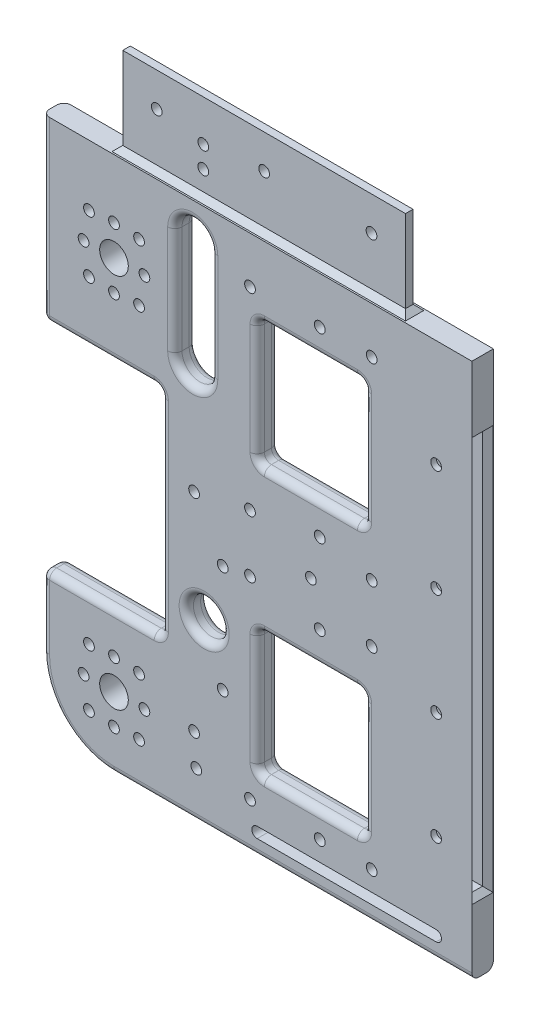
from build123d import *

# Parameters (mm, degrees)
SKETCH_1_W              = 120
SKETCH_1_H              = 150
EXTRUDE_305_DEPTH       = 3
SKETCH_3_W              = 2.9
SKETCH_3_H              = 110
CUT_EXTRUDE_479_DEPTH   = 20
SKETCH_4_W              = 79
SKETCH_4_H              = 2.1
EXTRUDE_650_DEPTH       = 24.5
SKETCH_5_W              = 33.2
SKETCH_5_H              = 60
CUT_EXTRUDE_912_DEPTH   = 10
SKETCH_7_R              = 1.5
CUT_EXTRUDE_1275_DEPTH  = 10
SKETCH_6_R              = 1.5
CUT_EXTRUDE_1586_DEPTH  = 10
SKETCH_8_R              = 1.5
CUT_EXTRUDE_1967_DEPTH  = 10
SKETCH_9_R              = 1.5
CUT_EXTRUDE_2487_DEPTH  = 10
SKETCH_14_R             = 1.5
CUT_EXTRUDE_3129_DEPTH  = 10
CUT_EXTRUDE_4236_DEPTH  = 10
SKETCH_16_R             = 5
SKETCH_16_W             = 30
SKETCH_16_H             = 35
CUT_EXTRUDE_4919_DEPTH  = 10
SKETCH_10_R             = 4
SKETCH_10_R_2           = 1.5
CUT_EXTRUDE_1_DEPTH     = 10
SKETCH_11_R             = 4
SKETCH_11_R_2           = 1.5
CUT_EXTRUDE_2_DEPTH     = 10
SKETCH_13_R             = 1.5
CUT_EXTRUDE_1_2_DEPTH   = 10
SKETCH_12_R             = 1.5
CUT_EXTRUDE_2_2_DEPTH   = 10
SKETCH_18_R             = 1.5
CUT_EXTRUDE_7600_DEPTH  = 10
CHAMFER_7649_SIZE       = 1.5
CHAMFER_7735_SIZE       = 1.5
FILLET_7819_R           = 20
FILLET_7890_R           = 2
FILLET_9097_R           = 2
FILLET_9538_R           = 2
CUT_EXTRUDE_10966_DEPTH = 10


with BuildPart() as part:
    # 草图1 → Extrude 305 (new, symmetric)
    with BuildSketch(Plane.XY):
        Rectangle(SKETCH_1_W, SKETCH_1_H)
    extrude(amount=EXTRUDE_305_DEPTH, both=True)

    # 草图3 → Cut-Extrude 479 (cut)
    with BuildSketch(Plane(origin=(60, 0, 0), x_dir=(0, 0, -1), z_dir=(1, 0, 0))):
        Rectangle(SKETCH_3_W, SKETCH_3_H)
    extrude(amount=-CUT_EXTRUDE_479_DEPTH, mode=Mode.SUBTRACT)

    # 草图4 → Extrude 650 (add)
    with BuildSketch(Plane(origin=(0, 75, 0), x_dir=(1, 0, 0), z_dir=(0, 1, 0))):
        Rectangle(SKETCH_4_W, SKETCH_4_H)
    extrude(amount=EXTRUDE_650_DEPTH)

    # 草图5 → Cut-Extrude 912 (cut)
    with BuildSketch(Plane.XY.offset(3)):
        with Locations((-43.4, -5)):
            Rectangle(SKETCH_5_W, SKETCH_5_H)
    extrude(amount=-CUT_EXTRUDE_912_DEPTH, mode=Mode.SUBTRACT)

    # 草图7 → Cut-Extrude 1275 (cut)
    with BuildSketch(Plane.XY.offset(3)):
        with Locations((50, 45)):
            Circle(SKETCH_7_R)
        with Locations((50, 15)):
            Circle(SKETCH_7_R)
        with Locations((50, -15)):
            Circle(SKETCH_7_R)
        with Locations((50, -45)):
            Circle(SKETCH_7_R)
    extrude(amount=-CUT_EXTRUDE_1275_DEPTH, mode=Mode.SUBTRACT)

    # 草图6 → Cut-Extrude 1586 (cut)
    with BuildSketch(Plane.XY.offset(1.05)):
        with Locations((-30, 90)):
            Circle(SKETCH_6_R)
        with Locations((0, 90)):
            Circle(SKETCH_6_R)
        with Locations((30, 90)):
            Circle(SKETCH_6_R)
    extrude(amount=-CUT_EXTRUDE_1586_DEPTH, mode=Mode.SUBTRACT)

    # 草图8 → Cut-Extrude 1967 (cut)
    with BuildSketch(Plane.XY.offset(3)):
        with Locations((17.5, 62)):
            Circle(SKETCH_8_R)
        with Locations((17.5, 11.2)):
            Circle(SKETCH_8_R)
        with Locations((17.5, -11.2)):
            Circle(SKETCH_8_R)
        with Locations((17.5, -62)):
            Circle(SKETCH_8_R)
    extrude(amount=-CUT_EXTRUDE_1967_DEPTH, mode=Mode.SUBTRACT)

    # 草图9 → Cut-Extrude 2487 (cut)
    with BuildSketch(Plane.XY.offset(3)):
        with Locations((-2, 62)):
            Circle(SKETCH_9_R)
        with Locations((32, -62)):
            Circle(SKETCH_9_R)
        with Locations((32, 62)):
            Circle(SKETCH_9_R)
        with Locations((-2, -62)):
            Circle(SKETCH_9_R)
        with Locations((-2, 8)):
            Circle(SKETCH_9_R)
        with Locations((-2, -8)):
            Circle(SKETCH_9_R)
        with Locations((32, 8)):
            Circle(SKETCH_9_R)
        with Locations((32, -8)):
            Circle(SKETCH_9_R)
    extrude(amount=-CUT_EXTRUDE_2487_DEPTH, mode=Mode.SUBTRACT)

    # 草图14 → Cut-Extrude 3129 (cut)
    with BuildSketch(Plane.XY.offset(3)):
        with Locations((-17.62, -53.4)):
            Circle(SKETCH_14_R)
        with Locations((-17.62, 4.6)):
            Circle(SKETCH_14_R)
        with Locations((-9.62, -9.4)):
            Circle(SKETCH_14_R)
        with Locations((-9.62, -39.4)):
            Circle(SKETCH_14_R)
    extrude(amount=-CUT_EXTRUDE_3129_DEPTH, mode=Mode.SUBTRACT)

    # 草图15 → Cut-Extrude 4236 (cut)
    with BuildSketch(Plane.XY.offset(3)):
        with BuildLine():
            ThreePointArc((-13, 65), (-18, 70), (-23, 65))
            Line((-23, 65), (-13, 65))
        make_face()
        with BuildLine():
            Line((-13, 65), (-23, 65))
            ThreePointArc((-23, 65), (-18, 60), (-13, 65))
        make_face()
        with BuildLine():
            ThreePointArc((-13, 65), (-18, 60), (-23, 65))
            Line((-23, 65), (-23, 35))
            ThreePointArc((-23, 35), (-18, 40), (-13, 35))
            Line((-13, 35), (-13, 65))
        make_face()
        with BuildLine():
            ThreePointArc((-13, 35), (-18, 40), (-23, 35))
            Line((-23, 35), (-13, 35))
        make_face()
        with BuildLine():
            Line((-13, 35), (-23, 35))
            ThreePointArc((-23, 35), (-18, 30), (-13, 35))
        make_face()
    extrude(amount=-CUT_EXTRUDE_4236_DEPTH, mode=Mode.SUBTRACT)

    # 草图16 → Cut-Extrude 4919 (cut)
    with BuildSketch(Plane.XY.offset(3)):
        with Locations((-14.8, -25)):
            Circle(SKETCH_16_R)
        with Locations((15, 37.5)):
            Rectangle(SKETCH_16_W, SKETCH_16_H)
        with Locations((15, -37.5)):
            Rectangle(SKETCH_16_W, SKETCH_16_H)
    extrude(amount=-CUT_EXTRUDE_4919_DEPTH, mode=Mode.SUBTRACT)

    # 草图10 → Cut-Extrude 1 (cut)
    with BuildSketch(Plane.XY.offset(3)):
        with Locations((-40, 50)):
            Circle(SKETCH_10_R)
        with Locations((-33, 58)):
            Circle(SKETCH_10_R_2)
        with Locations((-47, 58)):
            Circle(SKETCH_10_R_2)
        with Locations((-47, 42)):
            Circle(SKETCH_10_R_2)
        with Locations((-33, 42)):
            Circle(SKETCH_10_R_2)
        with Locations((-31.5, 50)):
            Circle(SKETCH_10_R_2)
        with Locations((-48.5, 50)):
            Circle(SKETCH_10_R_2)
        with Locations((-40, 58.5)):
            Circle(SKETCH_10_R_2)
        with Locations((-40, 41.5)):
            Circle(SKETCH_10_R_2)
    extrude(amount=-CUT_EXTRUDE_1_DEPTH, mode=Mode.SUBTRACT)

    # 草图11 → Cut-Extrude 2 (cut)
    with BuildSketch(Plane.XY.offset(3)):
        with Locations((-40, -55)):
            Circle(SKETCH_11_R)
        with Locations((-40, -46.5)):
            Circle(SKETCH_11_R_2)
        with Locations((-31.5, -55)):
            Circle(SKETCH_11_R_2)
        with Locations((-40, -63.5)):
            Circle(SKETCH_11_R_2)
        with Locations((-48.5, -55)):
            Circle(SKETCH_11_R_2)
        with Locations((-33, -63)):
            Circle(SKETCH_11_R_2)
        with Locations((-47, -63)):
            Circle(SKETCH_11_R_2)
        with Locations((-47, -47)):
            Circle(SKETCH_11_R_2)
        with Locations((-33, -47)):
            Circle(SKETCH_11_R_2)
    extrude(amount=-CUT_EXTRUDE_2_DEPTH, mode=Mode.SUBTRACT)

    # 草图13 → Cut-Extrude 1 2 (cut)
    with BuildSketch(Plane.XY.offset(1.05)):
        with Locations((-17, 88)):
            Circle(SKETCH_13_R)
        with Locations((-17, 82)):
            Circle(SKETCH_13_R)
    extrude(amount=-CUT_EXTRUDE_1_2_DEPTH, mode=Mode.SUBTRACT)

    # 草图12 → Cut-Extrude 2 2 (cut)
    with BuildSketch(Plane.XY.offset(3)):
        with Locations((-17, -62)):
            Circle(SKETCH_12_R)
    extrude(amount=-CUT_EXTRUDE_2_2_DEPTH, mode=Mode.SUBTRACT)

    # 草图18 → Cut-Extrude 7600 (cut)
    with BuildSketch(Plane.XY.offset(3)):
        with Locations((15, 0)):
            Circle(SKETCH_18_R)
    extrude(amount=-CUT_EXTRUDE_7600_DEPTH, mode=Mode.SUBTRACT)

    # Chamfer 7649
    chamfer_7649_edges = [part.edges().sort_by_distance(p)[0] for p in [
        (60, 0, -1.45),
        (60, 55, 0),
        (60, 0, 1.45),
        (60, -55, 0),
    ]]
    chamfer(chamfer_7649_edges, length=CHAMFER_7649_SIZE)

    # Chamfer 7735
    chamfer_7735_edges = [part.edges().sort_by_distance(p)[0] for p in [
        (39.5, 75, 0),
        (0, 75, -1.05),
        (-39.5, 75, 0),
        (0, 75, 1.05),
    ]]
    chamfer(chamfer_7735_edges, length=CHAMFER_7735_SIZE)

    # Fillet 7819
    fillet_7819_edges = [part.edges().sort_by_distance(p)[0] for p in [
        (-60, -75, 0),
    ]]
    fillet(fillet_7819_edges, radius=FILLET_7819_R)

    # Fillet 7890
    fillet_7890_edges = [part.edges().sort_by_distance(p)[0] for p in [
        (15, -55, -3),
        (30, -37.5, -3),
        (15, -20, -3),
        (0, -37.5, -3),
        (15, 20, -3),
        (30, 37.5, -3),
        (15, 55, -3),
        (0, 37.5, -3),
        (0, 20, 0),
        (0, 55, 0),
        (30, 55, 0),
        (30, 20, 0),
        (0, 37.5, 3),
        (15, 20, 3),
        (30, 37.5, 3),
        (15, 55, 3),
        (0, -55, 0),
        (0, -20, 0),
        (30, -20, 0),
        (30, -55, 0),
        (0, -37.5, 3),
        (15, -55, 3),
        (30, -37.5, 3),
        (15, -20, 3),
        (-19.8, -25, -3),
        (-19.8, -25, 3),
    ]]
    fillet(fillet_7890_edges, radius=FILLET_7890_R)

    # Fillet 9097
    fillet_9097_edges = [part.edges().sort_by_distance(p)[0] for p in [
        (-23, 50, -3),
        (-18, 30, -3),
        (-13, 50, -3),
        (-18, 70, -3),
        (-13, 50, 3),
        (-18, 70, 3),
        (-23, 50, 3),
        (-18, 30, 3),
    ]]
    fillet(fillet_9097_edges, radius=FILLET_9097_R)

    # Fillet 9538
    fillet_9538_edges = [part.edges().sort_by_distance(p)[0] for p in [
        (-60, 50, 3),
        (-60, -45, -3),
        (-43.4, -35, -3),
        (-26.8, -5, -3),
        (-43.4, 25, -3),
        (10, -75, -3),
        (10, -75, 3),
        (-54.142135624, -69.142135624, -3),
        (-54.142135624, -69.142135624, 3),
        (-60, -45, 3),
        (-60, -35, 0),
        (-60, 25, 0),
        (-26.8, 25, 0),
        (-26.8, -35, 0),
        (-43.4, -35, 3),
        (-26.8, -5, 3),
        (-43.4, 25, 3),
        (-60, 50, -3),
    ]]
    fillet(fillet_9538_edges, radius=FILLET_9538_R)

    # 草图19 → Cut-Extrude 10966 (cut)
    with BuildSketch(Plane.XY.offset(3)):
        with BuildLine():
            ThreePointArc((1.5, -69), (1.060660172, -67.939339828), (0, -67.5))
            Line((0, -67.5), (0, -70.5))
            ThreePointArc((0, -70.5), (1.060660172, -70.060660172), (1.5, -69))
        make_face()
        with BuildLine():
            Line((0, -70.5), (0, -67.5))
            ThreePointArc((0, -67.5), (-1.5, -69), (0, -70.5))
        make_face()
        with BuildLine():
            Line((50, -67.5), (0, -67.5))
            ThreePointArc((0, -67.5), (1.060660172, -67.939339828), (1.5, -69))
            ThreePointArc((1.5, -69), (1.060660172, -70.060660172), (0, -70.5))
            Line((0, -70.5), (50, -70.5))
            ThreePointArc((50, -70.5), (48.5, -69), (50, -67.5))
        make_face()
        with BuildLine():
            ThreePointArc((51.5, -69), (51.060660172, -67.939339828), (50, -67.5))
            Line((50, -67.5), (50, -70.5))
            ThreePointArc((50, -70.5), (51.060660172, -70.060660172), (51.5, -69))
        make_face()
        with BuildLine():
            Line((50, -70.5), (50, -67.5))
            ThreePointArc((50, -67.5), (48.5, -69), (50, -70.5))
        make_face()
    extrude(amount=-CUT_EXTRUDE_10966_DEPTH, mode=Mode.SUBTRACT)


solid = part.part
